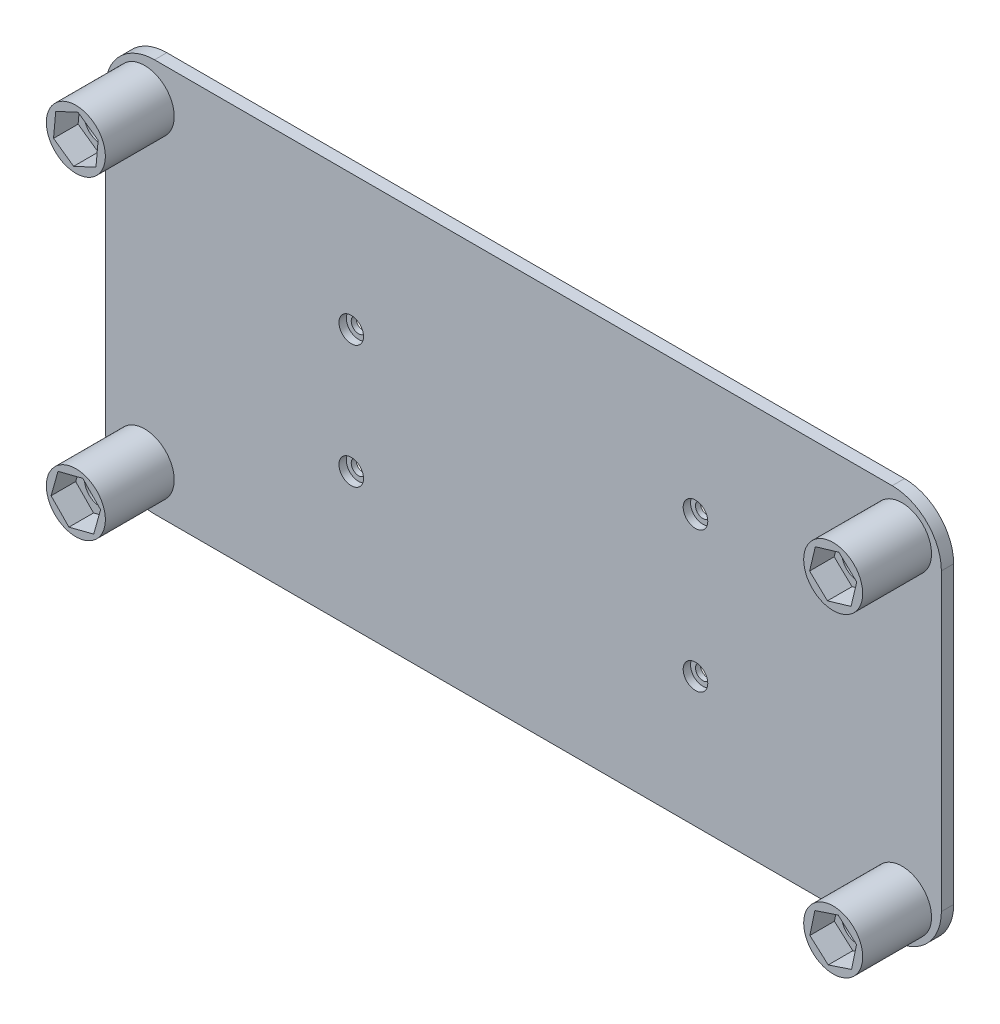
from build123d import *

# Parameters (mm, degrees)
EXTRUDE_1_DEPTH          = 2.5
CUT_EXTRUDE_1_DEPTH      = 42
CUT_EXTRUDE_1_DEPTH_BACK = 10
SKETCH_2_R               = 1.5
SKETCH_3_R               = 2.5
CUT_EXTRUDE_2_DEPTH      = 1.5
SKETCH_7_R               = 6
EXTRUDE_4_DEPTH          = 14
BUTTON_LEFT_NUT_DEPTH    = 5
UP_LEFT_NUT_DEPTH        = 5
UP_RIGHT_NUT_DEPTH       = 5
BUTTON_RIGHT_NUT_DEPTH   = 5
SKETCH_13_R              = 3.25
CUT_EXTRUDE_7_DEPTH      = 13
SKETCH_15_R              = 3.25
CUT_EXTRUDE_8_DEPTH      = 13
SKETCH_16_R              = 3.25
CUT_EXTRUDE_9_DEPTH      = 13
SKETCH_17_R              = 3.25
CUT_EXTRUDE_10_DEPTH     = 13


with BuildPart() as part:
    # 草图1 → 凸台-拉伸1 (new body)
    with BuildSketch(Plane.XY):
        with BuildLine():
            Line((-72.574116531, 35.487390308), (77.425883469, 35.487390308))
            ThreePointArc((77.425883469, 35.487390308), (84.496951281, 32.558458119), (87.425883469, 25.487390308))
            Line((87.425883469, 25.487390308), (87.425883469, -34.512609692))
            ThreePointArc((87.425883469, -34.512609692), (84.496951281, -41.583677504), (77.425883469, -44.512609692))
            Line((77.425883469, -44.512609692), (-72.574116531, -44.512609692))
            ThreePointArc((-72.574116531, -44.512609692), (-79.645184343, -41.583677504), (-82.574116531, -34.512609692))
            Line((-82.574116531, -34.512609692), (-82.574116531, 25.487390308))
            ThreePointArc((-82.574116531, 25.487390308), (-79.645184343, 32.558458119), (-72.574116531, 35.487390308))
        make_face()
    extrude(amount=EXTRUDE_1_DEPTH)

    # 草图2 → 切除-拉伸1 (cut, two sides: drawn at the far end of the back side and taken through both)
    with BuildSketch(Plane.XY.offset(2.5).offset(-CUT_EXTRUDE_1_DEPTH_BACK)):
        with Locations((-32.574116531, 7.987390308)):
            Circle(SKETCH_2_R)
        with Locations((-32.574116531, -17.012609692)):
            Circle(SKETCH_2_R)
        with Locations((37.425883469, 10.450230815)):
            Circle(SKETCH_2_R)
        with Locations((37.425883469, -18.090102414)):
            Circle(SKETCH_2_R)
    extrude(amount=CUT_EXTRUDE_1_DEPTH + CUT_EXTRUDE_1_DEPTH_BACK, mode=Mode.SUBTRACT)

    # 草图3 → 切除-拉伸2 (cut)
    with BuildSketch(Plane.XY.offset(2.5)):
        with Locations((-32.574116531, 7.987390308)):
            Circle(SKETCH_3_R)
        with Locations((37.425883469, 10.450230815)):
            Circle(SKETCH_3_R)
        with Locations((37.425883469, -18.090102414)):
            Circle(SKETCH_3_R)
        with Locations((-32.574116531, -17.012609692)):
            Circle(SKETCH_3_R)
    extrude(amount=-CUT_EXTRUDE_2_DEPTH, mode=Mode.SUBTRACT)

    # 草图7 → 凸台-拉伸4 (add)
    with BuildSketch(Plane.XY.offset(2.5)):
        with Locations(Location((-74.574116531, 27.487390308, 0), (0, 0, 180))):
            Circle(SKETCH_7_R)
        with Locations(Location((-74.574116531, -36.512609692, 0), (0, 0, 180))):
            Circle(SKETCH_7_R)
        with Locations(Location((79.425883469, 27.487390308, 0), (0, 0, 180))):
            Circle(SKETCH_7_R)
        with Locations(Location((79.425883469, -36.512609692, 0), (0, 0, 180))):
            Circle(SKETCH_7_R)
    extrude(amount=EXTRUDE_4_DEPTH)

    # 草图9 → button left nut (cut)
    with BuildSketch(Plane.XY.offset(16.5)):
        Polygon((-70.944636645, -40.226166125), (-69.543342379, -35.226166125), (-73.172822265, -31.512609692), (-78.203596417, -32.79905326), (-79.604890683, -37.79905326), (-75.975410797, -41.512609692), align=None)
    extrude(amount=-BUTTON_LEFT_NUT_DEPTH, mode=Mode.SUBTRACT)

    # 草图10 → up left nut (cut)
    with BuildSketch(Plane.XY.offset(16.5)):
        Polygon((-70.484611493, 24.610595469), (-70.0379866, 29.59060814), (-74.127491638, 32.467402979), (-78.663621569, 30.364185146), (-79.110246462, 25.384172475), (-75.020741423, 22.507377636), align=None)
    extrude(amount=-UP_LEFT_NUT_DEPTH, mode=Mode.SUBTRACT)

    # 草图11 → up right nut (cut)
    with BuildSketch(Plane.XY.offset(16.5)):
        Polygon((83.054173559, 24.047112554), (84.219396445, 28.909442821), (80.591106355, 32.349720575), (75.797593379, 30.927668061), (74.632370493, 26.065337794), (78.260660583, 22.62506004), align=None)
    extrude(amount=-UP_RIGHT_NUT_DEPTH, mode=Mode.SUBTRACT)

    # 草图12 → button right nut (cut)
    with BuildSketch(Plane.XY.offset(16.5)):
        Polygon((83.162930062, -39.834428887), (84.171186575, -34.937142005), (80.434139981, -31.61532281), (75.688836876, -33.190790498), (74.680580363, -38.08807738), (78.417626957, -41.409896575), align=None)
    extrude(amount=-BUTTON_RIGHT_NUT_DEPTH, mode=Mode.SUBTRACT)

    # 草图13 → 切除-拉伸7 (cut)
    with BuildSketch(Plane.XY.offset(16.5)):
        with Locations((-74.574116531, -36.512609692)):
            Circle(SKETCH_13_R)
    extrude(amount=-CUT_EXTRUDE_7_DEPTH, mode=Mode.SUBTRACT)

    # 草图15 → 切除-拉伸8 (cut)
    with BuildSketch(Plane.XY.offset(16.5)):
        with Locations((-74.574116531, 27.487390308)):
            Circle(SKETCH_15_R)
    extrude(amount=-CUT_EXTRUDE_8_DEPTH, mode=Mode.SUBTRACT)

    # 草图16 → 切除-拉伸9 (cut)
    with BuildSketch(Plane.XY.offset(16.5)):
        with Locations((79.425883469, 27.487390308)):
            Circle(SKETCH_16_R)
    extrude(amount=-CUT_EXTRUDE_9_DEPTH, mode=Mode.SUBTRACT)

    # 草图17 → 切除-拉伸10 (cut)
    with BuildSketch(Plane.XY.offset(16.5)):
        with Locations((79.425883469, -36.512609692)):
            Circle(SKETCH_17_R)
    extrude(amount=-CUT_EXTRUDE_10_DEPTH, mode=Mode.SUBTRACT)


solid = part.part
